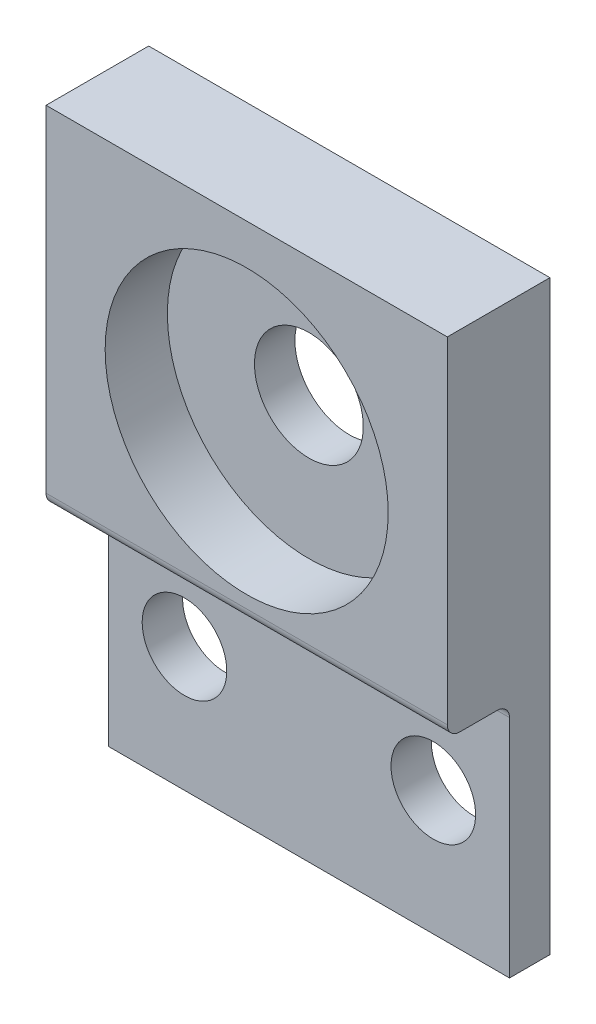
from build123d import *

# Parameters (mm, degrees)
SKETCH1_W           = 32.25
SKETCH1_H           = 47.125
SKETCH1_R           = 3.400367627
SKETCH1_R_2         = 4.375
BOSS_EXTRUDE1_DEPTH = 3.25
SKETCH1_3_W         = 32.25
SKETCH1_3_H         = 28
SKETCH1_3_R         = 11.375
BOSS_EXTRUDE2_DEPTH = 8.25
FILLET1_R           = 1


with BuildPart() as part:
    # Sketch1 → Boss-Extrude1 (new body)
    with BuildSketch(Plane.XY):
        with Locations((16.125, 23.5625)):
            Rectangle(SKETCH1_W, SKETCH1_H)
        with Locations((6.125, 10)):
            Circle(SKETCH1_R, mode=Mode.SUBTRACT)
        with Locations((26.125, 10)):
            Circle(SKETCH1_R, mode=Mode.SUBTRACT)
        with Locations((16.125, 32.5)):
            Circle(SKETCH1_R_2, mode=Mode.SUBTRACT)
    extrude(amount=BOSS_EXTRUDE1_DEPTH)

    # Sketch1<3> → Boss-Extrude2 (add)
    with BuildSketch(Plane.XY):
        with Locations((16.125, 33.125)):
            Rectangle(SKETCH1_3_W, SKETCH1_3_H)
        with Locations((16.125, 32.5)):
            Circle(SKETCH1_3_R, mode=Mode.SUBTRACT)
    extrude(amount=BOSS_EXTRUDE2_DEPTH)

    # Fillet1
    fillet1_edges = [part.edges().sort_by_distance(p)[0] for p in [
        (16.125, 19.125, 8.25),
        (16.125, 19.125, 3.25),
    ]]
    fillet(fillet1_edges, radius=FILLET1_R)


solid = part.part
